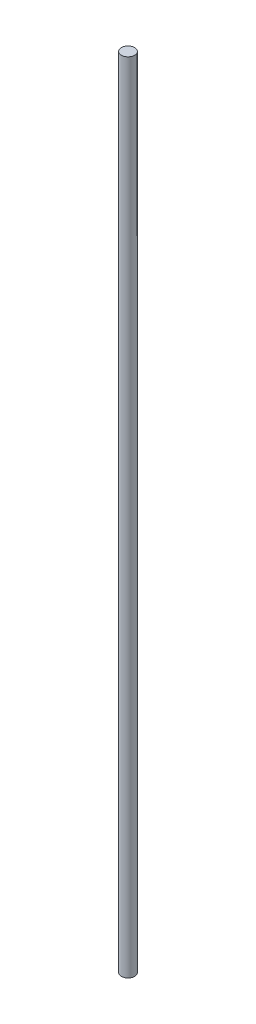
from build123d import *

# Parameters (mm, degrees)
SKETCH1_R           = 1.5
BOSS_EXTRUDE1_DEPTH = 90


with BuildPart() as part:
    # Sketch1 → Boss-Extrude1 (new, symmetric)
    with BuildSketch(Plane(origin=(0, 0, 0), x_dir=(1, 0, 0), z_dir=(0, 1, 0))):
        Circle(SKETCH1_R)
    extrude(amount=BOSS_EXTRUDE1_DEPTH, both=True)


solid = part.part
